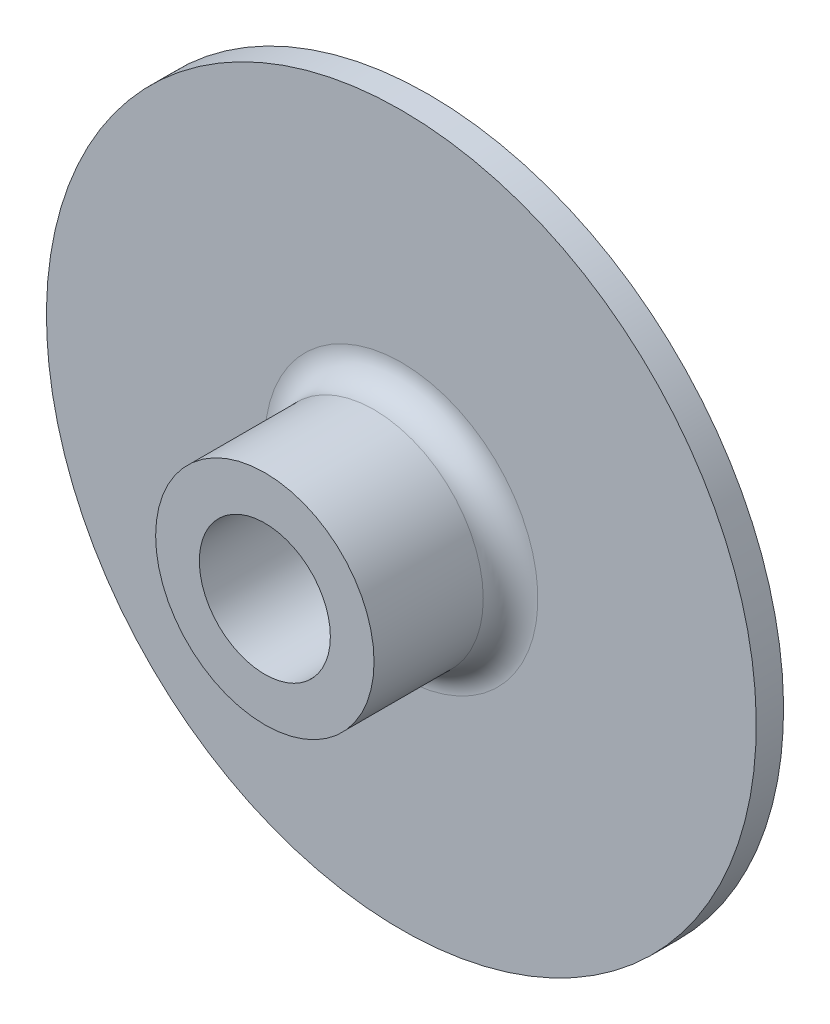
from build123d import *

# Parameters (mm, degrees)
CUT_SKETCH_R     = 7.62
CENTER_CUT_DEPTH = 62.401577748
FILLET_2_R       = 3.175


with BuildPart() as part:
    # Revolve Sketch → Revolve 2 (revolve)
    with BuildSketch(Plane(origin=(0, 0, 0), x_dir=(0, 0, -1), z_dir=(1, 0, 0))):
        Polygon((0, 0), (0, 41.275), (-3.175, 41.275), (-3.175, 12.7), (-19.05, 12.7), (-19.05, 0), align=None)
    revolve(axis=Axis((0, 0, 0), (0, 0, 1)))

    # Cut Sketch → Center Cut (cut, through all)
    with BuildSketch(Plane.XY.offset(19.05)):
        Circle(CUT_SKETCH_R)
    extrude(amount=-CENTER_CUT_DEPTH, mode=Mode.SUBTRACT)

    # Fillet 2
    fillet_2_edges = [part.edges().sort_by_distance(p)[0] for p in [
        (0, -12.7, 3.175),
    ]]
    fillet(fillet_2_edges, radius=FILLET_2_R)


solid = part.part
